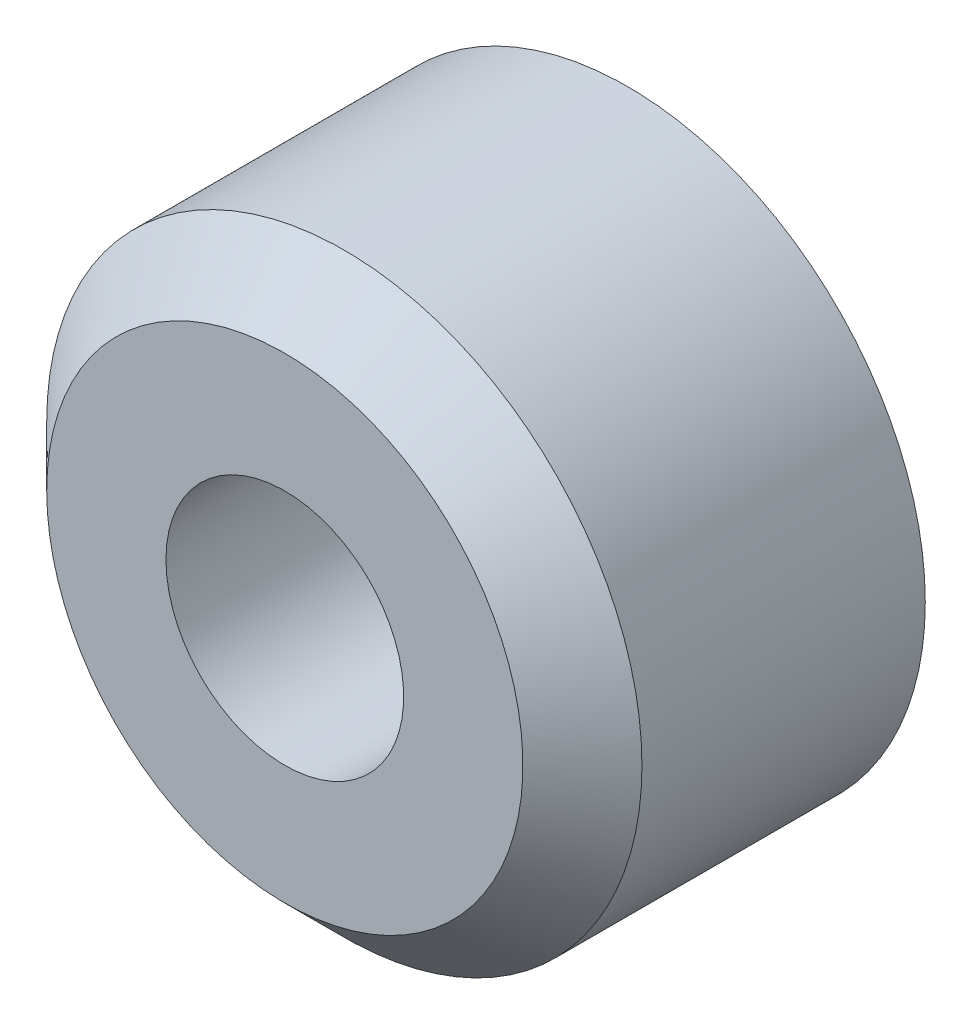
from build123d import *


with BuildPart() as part:
    # Sketch1 → Revolve1 (revolve)
    with BuildSketch(Plane.XZ, mode=Mode.PRIVATE) as revolve1_sk:
        Polygon((3.96875, 3.77825), (3.175, 4.572), (1.58496, 4.572), (1.58496, 0), (3.96875, 0), align=None)
    revolve(revolve1_sk.sketch.rotate(Axis((0, 0, 4.572), (0, 0, -1)), 180), axis=Axis((0, 0, 4.572), (0, 0, -1)))


solid = part.part
